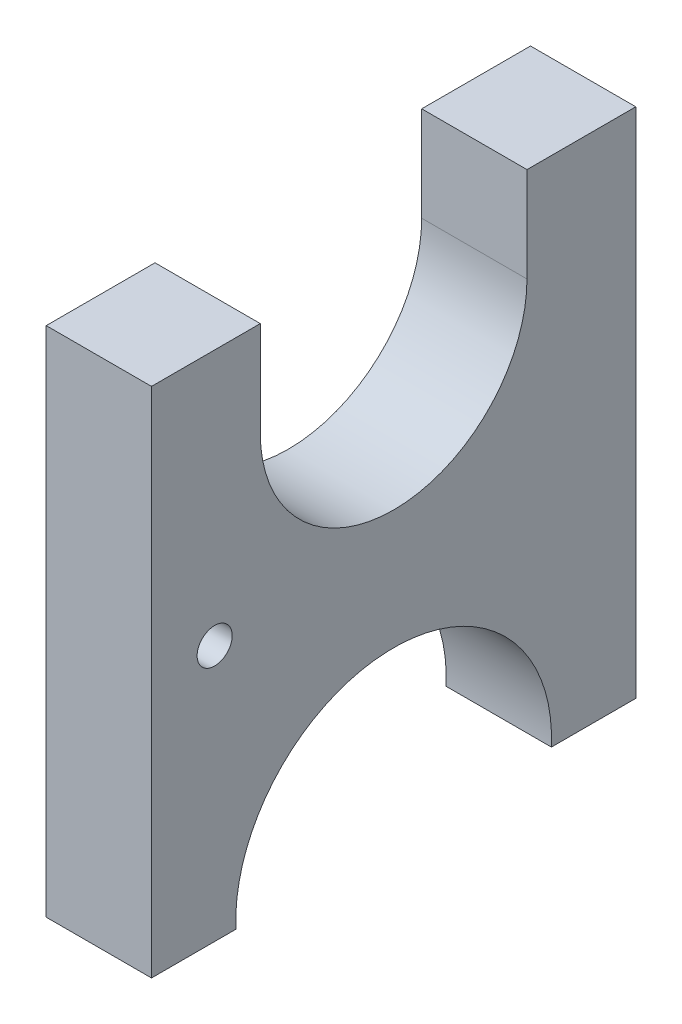
from build123d import *

# Parameters (mm, degrees)
BOSS_EXTRUDE1_DEPTH = 12
CUT_EXTRUDE1_DEPTH  = 80.418196907
SKETCH7_R           = 2.5
CUT_EXTRUDE2_DEPTH  = 80.418196907
SKETCH8_R           = 2.5
BOSS_EXTRUDE2_DEPTH = 15


with BuildPart() as part:
    # Sketch1 → Boss-Extrude1 (new body)
    with BuildSketch(Plane(origin=(0, 0, 0), x_dir=(0, 0, -1), z_dir=(1, 0, 0))):
        with BuildLine():
            Line((-33.5, 0), (33.5, 0))
            Line((33.5, 0), (33.5, -71))
            Line((33.5, -71), (23.5, -71))
            ThreePointArc((23.5, -71), (0, -47.5), (-23.5, -71))
            Line((-23.5, -71), (-33.5, -71))
            Line((-33.5, -71), (-33.5, 0))
        make_face()
    extrude(amount=BOSS_EXTRUDE1_DEPTH)

    # Sketch6 → Cut-Extrude1 (cut, through all)
    with BuildSketch(Plane(origin=(12, 0, 0), x_dir=(0, 0, -1), z_dir=(1, 0, 0))):
        with BuildLine():
            Line((20, 12.5), (20, -12.5))
            ThreePointArc((20, -12.5), (0, -32.5), (-20, -12.5))
            Line((-20, -12.5), (-20, 12.5))
            ThreePointArc((-20, 12.5), (0, 32.5), (20, 12.5))
        make_face()
    extrude(amount=-CUT_EXTRUDE1_DEPTH, mode=Mode.SUBTRACT)

    # Sketch7 → Cut-Extrude2 (cut, through all)
    with BuildSketch(Plane(origin=(12, 0, 0), x_dir=(0, 0, -1), z_dir=(1, 0, 0))):
        with Locations((-25.5, -35.5)):
            Circle(SKETCH7_R)
    extrude(amount=-CUT_EXTRUDE2_DEPTH, mode=Mode.SUBTRACT)

    # Sketch8 → Boss-Extrude2 (add)
    with BuildSketch(Plane(origin=(12, 0, 0), x_dir=(0, 0, -1), z_dir=(1, 0, 0))):
        with BuildLine():
            Line((-19, 1), (-34.5, 1))
            Line((-34.5, 1), (-34.5, -72))
            Line((-34.5, -72), (-22.477766793, -72))
            ThreePointArc((-22.477766793, -72), (0, -48.5), (22.477766793, -72))
            Line((22.477766793, -72), (34.5, -72))
            Line((34.5, -72), (34.5, 1))
            Line((34.5, 1), (19, 1))
            Line((19, 1), (19, -12.5))
            ThreePointArc((19, -12.5), (0, -31.5), (-19, -12.5))
            Line((-19, -12.5), (-19, 1))
        make_face()
        with Locations((-25.5, -35.5)):
            Circle(SKETCH8_R, mode=Mode.SUBTRACT)
    extrude(amount=-BOSS_EXTRUDE2_DEPTH)


solid = part.part
